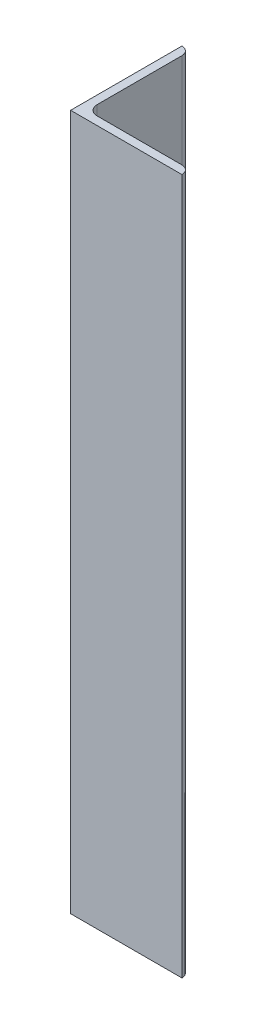
from build123d import *

# Parameters (mm, degrees)
IRON_V40X40X3_1_DEPTH = 250


with BuildPart() as part:
    # Sketch11 → Iron V40X40X3(1) (new body)
    with BuildSketch(Plane(origin=(0, 0, 0), x_dir=(1, 0, 0), z_dir=(0, 1, 0))):
        with BuildLine():
            Line((0, 0), (0, 40))
            ThreePointArc((0, 40), (2.121320344, 39.121320344), (3, 37))
            Line((3, 37), (3, 6.5))
            ThreePointArc((3, 6.5), (4.025126266, 4.025126266), (6.5, 3))
            Line((6.5, 3), (37, 3))
            ThreePointArc((37, 3), (39.121320344, 2.121320344), (40, 0))
            Line((40, 0), (0, 0))
        make_face()
    extrude(amount=IRON_V40X40X3_1_DEPTH)


solid = part.part
